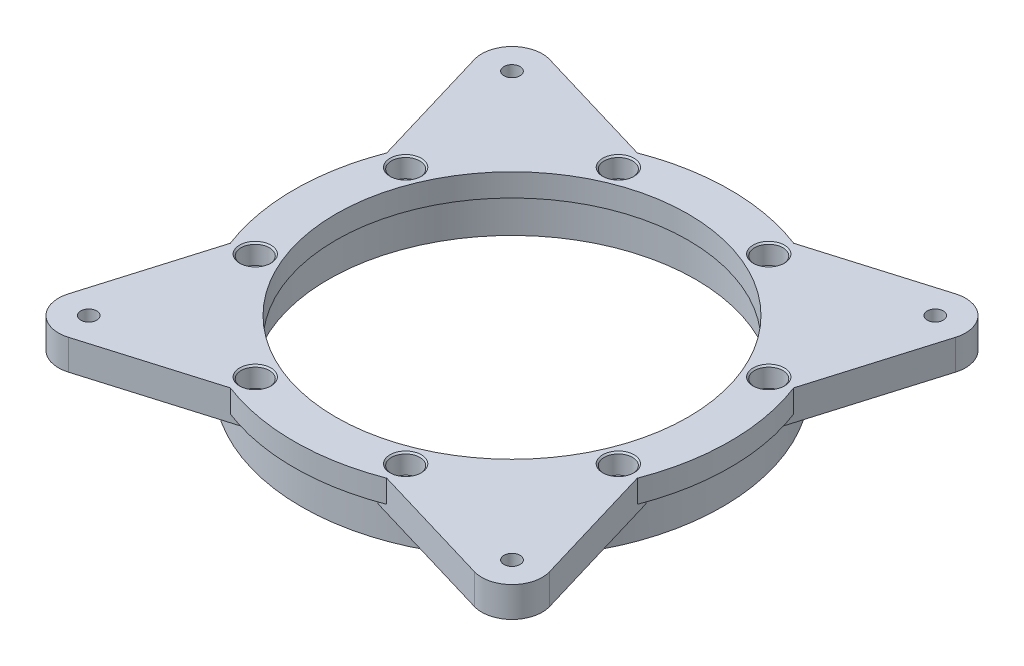
from build123d import *

# Parameters (mm, degrees)
SKETCH2_R                                     = 88.395010725
SKETCH2_R_2                                   = 77.1365
BOSS_EXTRUDE1_DEPTH                           = 25.4
BOSS_EXTRUDE2_START                           = -12.7
BOSS_EXTRUDE2_DEPTH                           = 12.7
CBORE_FOR_1_4_SOCKET_HEAD_CAP_SCREW1_AT_COUNT = 2
CBORE_FOR_1_4_SOCKET_HEAD_CAP_SCREW1_AT_PITCH = 177.8
CBORE_FOR_1_4_SOCKET_HEAD_CAP_SCREW1_2_COUNT  = 2
CBORE_FOR_1_4_SOCKET_HEAD_CAP_SCREW1_2_PITCH  = 251.44717139
CBORE_FOR_1_4_SOCKET_HEAD_CAP_SCREW1_3_COUNT  = 2
CBORE_FOR_1_4_SOCKET_HEAD_CAP_SCREW1_3_PITCH  = 177.8
SKETCH10_R                                    = 91.570010725
SKETCH10_R_2                                  = 73.9615
BOSS_EXTRUDE3_DEPTH                           = 9.525
CBORE_FOR_1_4_BUTTON_HEAD_CAP_SCREW1_AT_COUNT = 2
CBORE_FOR_1_4_BUTTON_HEAD_CAP_SCREW1_AT_PITCH = 63.181034683
CBORE_FOR_1_4_BUTTON_HEAD_CAP_SCREW1_2_COUNT  = 2
CBORE_FOR_1_4_BUTTON_HEAD_CAP_SCREW1_2_PITCH  = 116.743329574
CBORE_FOR_1_4_BUTTON_HEAD_CAP_SCREW1_3_COUNT  = 2
CBORE_FOR_1_4_BUTTON_HEAD_CAP_SCREW1_3_PITCH  = 152.532510818
CBORE_FOR_1_4_BUTTON_HEAD_CAP_SCREW1_4_COUNT  = 2
CBORE_FOR_1_4_BUTTON_HEAD_CAP_SCREW1_4_PITCH  = 165.1
CBORE_FOR_1_4_BUTTON_HEAD_CAP_SCREW1_5_COUNT  = 2
CBORE_FOR_1_4_BUTTON_HEAD_CAP_SCREW1_5_PITCH  = 152.532510818
CBORE_FOR_1_4_BUTTON_HEAD_CAP_SCREW1_6_COUNT  = 2
CBORE_FOR_1_4_BUTTON_HEAD_CAP_SCREW1_6_PITCH  = 116.743329574
CBORE_FOR_1_4_BUTTON_HEAD_CAP_SCREW1_7_COUNT  = 2
CBORE_FOR_1_4_BUTTON_HEAD_CAP_SCREW1_7_PITCH  = 63.181034683


with BuildPart() as part:
    # Sketch2 → Boss-Extrude1 (new body)
    with BuildSketch(Plane(origin=(0, 0, 0), x_dir=(1, 0, 0), z_dir=(0, 1, 0))):
        with Locations(Location((112.864370177, 65.400443246, 0), (0, 0, 270))):
            Circle(SKETCH2_R)
        with Locations(Location((112.864370177, 65.400443246, 0), (0, 0, 270))):
            Circle(SKETCH2_R_2, mode=Mode.SUBTRACT)
    extrude(amount=BOSS_EXTRUDE1_DEPTH)

    # Sketch7 → Boss-Extrude2 (add)
    with BuildSketch(Plane(origin=(0, 25.4, 0), x_dir=(1, 0, 0), z_dir=(0, 1, 0)).offset(BOSS_EXTRUDE2_START)):
        with BuildLine():
            Line((27.586360499, 166.473001979), (85.159974048, 149.341758199))
            ThreePointArc((85.159974048, 149.341758199), (50.359658671, 127.905154752), (28.923055224, 93.104839375))
            Line((28.923055224, 93.104839375), (11.791811444, 150.678452924))
            ThreePointArc((11.791811444, 150.678452924), (14.984114056, 163.280699367), (27.586360499, 166.473001979))
        make_face()
        with BuildLine():
            Line((198.142379855, 166.473001979), (140.568766306, 149.341758199))
            ThreePointArc((140.568766306, 149.341758199), (175.369081684, 127.905154752), (196.805685131, 93.104839375))
            Line((196.805685131, 93.104839375), (213.93692891, 150.678452924))
            ThreePointArc((213.93692891, 150.678452924), (210.744626298, 163.280699367), (198.142379855, 166.473001979))
        make_face()
        with BuildLine():
            Line((213.93692891, -19.877566432), (196.805685131, 37.696047117))
            ThreePointArc((196.805685131, 37.696047117), (175.369081684, 2.89573174), (140.568766306, -18.540871708))
            Line((140.568766306, -18.540871708), (198.142379855, -35.672115487))
            ThreePointArc((198.142379855, -35.672115487), (210.744626298, -32.479812875), (213.93692891, -19.877566432))
        make_face()
        with BuildLine():
            Line((27.586360499, -35.672115487), (85.159974048, -18.540871708))
            ThreePointArc((85.159974048, -18.540871708), (50.359658671, 2.89573174), (28.923055224, 37.696047117))
            Line((28.923055224, 37.696047117), (11.791811444, -19.877566432))
            ThreePointArc((11.791811444, -19.877566432), (14.984114056, -32.479812875), (27.586360499, -35.672115487))
        make_face()
    extrude(amount=BOSS_EXTRUDE2_DEPTH)

    # Sketch9 → CBORE for 1/4 Socket Head Cap Screw1 (revolve, cut)
    with BuildSketch(Plane(origin=(23.964370177, 12.7, 23.499556754), x_dir=(0, 0, -1), z_dir=(1, 0, 0))):
        Polygon((0, 0), (0, 12.7), (3.3782, 12.7), (3.3782, 6.35), (5.55625, 6.35), (5.55625, 0.635), (6.19125, 0), align=None)
    cbore_for_1_4_socket_head_cap_screw1 = revolve(axis=Axis((23.964370177, 6.35, 23.499556754), (0, 1, 0)), mode=Mode.SUBTRACT)

    # CBORE for 1/4 Socket Head Cap Screw1 at: CBORE for 1/4 Socket Head Cap Screw1 ×2
    with Locations(*[(i * CBORE_FOR_1_4_SOCKET_HEAD_CAP_SCREW1_AT_PITCH, 0, 0) for i in range(1, CBORE_FOR_1_4_SOCKET_HEAD_CAP_SCREW1_AT_COUNT)]):
        add(cbore_for_1_4_socket_head_cap_screw1, mode=Mode.SUBTRACT)

    # CBORE for 1_4 Socket Head Cap Screw1 2: CBORE for 1/4 Socket Head Cap Screw1 ×2
    with Locations(*[Vector(0.7071067811865512, 0, -0.7071067811865438) * (i * CBORE_FOR_1_4_SOCKET_HEAD_CAP_SCREW1_2_PITCH) for i in range(1, CBORE_FOR_1_4_SOCKET_HEAD_CAP_SCREW1_2_COUNT)]):
        add(cbore_for_1_4_socket_head_cap_screw1, mode=Mode.SUBTRACT)

    # CBORE for 1_4 Socket Head Cap Screw1 3: CBORE for 1/4 Socket Head Cap Screw1 ×2
    with Locations(*[(0, 0, -i * CBORE_FOR_1_4_SOCKET_HEAD_CAP_SCREW1_3_PITCH) for i in range(1, CBORE_FOR_1_4_SOCKET_HEAD_CAP_SCREW1_3_COUNT)]):
        add(cbore_for_1_4_socket_head_cap_screw1, mode=Mode.SUBTRACT)

    # Sketch10 → Boss-Extrude3 (add)
    with BuildSketch(Plane(origin=(0, 25.4, 0), x_dir=(1, 0, 0), z_dir=(0, 1, 0))):
        with Locations((112.864370177, 65.400443246)):
            Circle(SKETCH10_R)
        with Locations(Location((112.864370177, 65.400443246, 0), (0, 0, 270))):
            Circle(SKETCH10_R_2, mode=Mode.SUBTRACT)
    extrude(amount=-BOSS_EXTRUDE3_DEPTH)

    # Sketch12 → CBORE for 1/4 Button Head Cap Screw1 (revolve, cut)
    with BuildSketch(Plane(origin=(36.598114768, 25.4, -33.809925904), x_dir=(0, 0, 1), z_dir=(1, 0, 0))):
        Polygon((0, 0), (0, 25.4), (3.3782, 25.4), (3.3782, 8.35279), (5.95376, 8.35279), (5.95376, 0.635), (6.58876, 0), align=None)
    cbore_for_1_4_button_head_cap_screw1 = revolve(axis=Axis((36.598114768, 31.75, -33.809925904), (0, -1, 0)), mode=Mode.SUBTRACT)

    # CBORE for 1/4 Button Head Cap Screw1 at: CBORE for 1/4 Button Head Cap Screw1 ×2
    with Locations(*[(0, 0, -i * CBORE_FOR_1_4_BUTTON_HEAD_CAP_SCREW1_AT_PITCH) for i in range(1, CBORE_FOR_1_4_BUTTON_HEAD_CAP_SCREW1_AT_COUNT)]):
        add(cbore_for_1_4_button_head_cap_screw1, mode=Mode.SUBTRACT)

    # CBORE for 1_4 Button Head Cap Screw1 2: CBORE for 1/4 Button Head Cap Screw1 ×2
    with Locations(*[Vector(0.3826834323650937, 0, -0.9238795325112852) * (i * CBORE_FOR_1_4_BUTTON_HEAD_CAP_SCREW1_2_PITCH) for i in range(1, CBORE_FOR_1_4_BUTTON_HEAD_CAP_SCREW1_2_COUNT)]):
        add(cbore_for_1_4_button_head_cap_screw1, mode=Mode.SUBTRACT)

    # CBORE for 1_4 Button Head Cap Screw1 3: CBORE for 1/4 Button Head Cap Screw1 ×2
    with Locations(*[Vector(0.7071067811865462, 0, -0.7071067811865489) * (i * CBORE_FOR_1_4_BUTTON_HEAD_CAP_SCREW1_3_PITCH) for i in range(1, CBORE_FOR_1_4_BUTTON_HEAD_CAP_SCREW1_3_COUNT)]):
        add(cbore_for_1_4_button_head_cap_screw1, mode=Mode.SUBTRACT)

    # CBORE for 1_4 Button Head Cap Screw1 4: CBORE for 1/4 Button Head Cap Screw1 ×2
    with Locations(*[Vector(0.9238795325112864, 0, -0.38268343236509067) * (i * CBORE_FOR_1_4_BUTTON_HEAD_CAP_SCREW1_4_PITCH) for i in range(1, CBORE_FOR_1_4_BUTTON_HEAD_CAP_SCREW1_4_COUNT)]):
        add(cbore_for_1_4_button_head_cap_screw1, mode=Mode.SUBTRACT)

    # CBORE for 1_4 Button Head Cap Screw1 5: CBORE for 1/4 Button Head Cap Screw1 ×2
    with Locations(*[(i * CBORE_FOR_1_4_BUTTON_HEAD_CAP_SCREW1_5_PITCH, 0, 0) for i in range(1, CBORE_FOR_1_4_BUTTON_HEAD_CAP_SCREW1_5_COUNT)]):
        add(cbore_for_1_4_button_head_cap_screw1, mode=Mode.SUBTRACT)

    # CBORE for 1_4 Button Head Cap Screw1 6: CBORE for 1/4 Button Head Cap Screw1 ×2
    with Locations(*[Vector(0.9238795325112864, 0, 0.3826834323650908) * (i * CBORE_FOR_1_4_BUTTON_HEAD_CAP_SCREW1_6_PITCH) for i in range(1, CBORE_FOR_1_4_BUTTON_HEAD_CAP_SCREW1_6_COUNT)]):
        add(cbore_for_1_4_button_head_cap_screw1, mode=Mode.SUBTRACT)

    # CBORE for 1_4 Button Head Cap Screw1 7: CBORE for 1/4 Button Head Cap Screw1 ×2
    with Locations(*[Vector(0.7071067811865459, 0, 0.7071067811865491) * (i * CBORE_FOR_1_4_BUTTON_HEAD_CAP_SCREW1_7_PITCH) for i in range(1, CBORE_FOR_1_4_BUTTON_HEAD_CAP_SCREW1_7_COUNT)]):
        add(cbore_for_1_4_button_head_cap_screw1, mode=Mode.SUBTRACT)


solid = part.part
